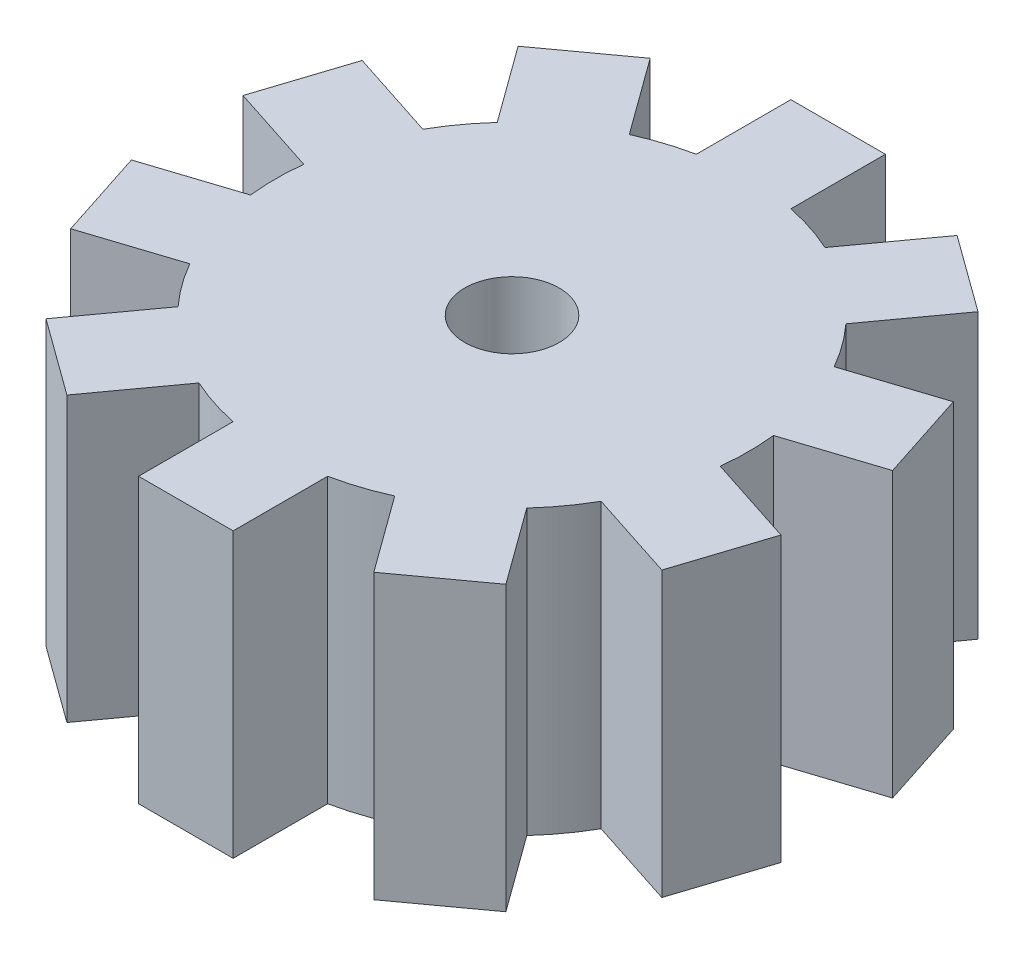
from build123d import *

# Parameters (mm, degrees)
SKETCH_1_R      = 5
EXTRUDE_1_DEPTH = 30


with BuildPart() as part:
    # 草圖1 → 填料-伸長1 (new body)
    with BuildSketch(Plane(origin=(0, 0, 0), x_dir=(1, 0, 0), z_dir=(0, 1, 0))):
        with BuildLine():
            Line((24.320676959, 24.968031977), (16.230507016, 30.8458845))
            Line((16.230507016, 30.8458845), (10.352654493, 22.755714556))
            ThreePointArc((10.352654493, 22.755714556), (7.725424859, 23.776412907), (5, 24.494897428))
            Line((5, 24.494897428), (5, 34.494897428))
            Line((5, 34.494897428), (-5, 34.494897428))
            Line((-5, 34.494897428), (-5, 24.494897428))
            ThreePointArc((-5, 24.494897428), (-7.725424859, 23.776412907), (-10.352654493, 22.755714556))
            Line((-10.352654493, 22.755714556), (-16.230507016, 30.8458845))
            Line((-16.230507016, 30.8458845), (-24.320676959, 24.968031977))
            Line((-24.320676959, 24.968031977), (-18.442824436, 16.877862033))
            ThreePointArc((-18.442824436, 16.877862033), (-20.225424859, 14.694631307), (-21.750946843, 12.324622162))
            Line((-21.750946843, 12.324622162), (-31.261512006, 15.414792106))
            Line((-31.261512006, 15.414792106), (-34.35168195, 5.904226943))
            Line((-34.35168195, 5.904226943), (-24.841116787, 2.814056999))
            ThreePointArc((-24.841116787, 2.814056999), (-25, 0), (-24.841116787, -2.814056999))
            Line((-24.841116787, -2.814056999), (-34.35168195, -5.904226943))
            Line((-34.35168195, -5.904226943), (-31.261512006, -15.414792106))
            Line((-31.261512006, -15.414792106), (-21.750946843, -12.324622162))
            ThreePointArc((-21.750946843, -12.324622162), (-20.225424859, -14.694631307), (-18.442824436, -16.877862033))
            Line((-18.442824436, -16.877862033), (-24.320676959, -24.968031977))
            Line((-24.320676959, -24.968031977), (-16.230507016, -30.8458845))
            Line((-16.230507016, -30.8458845), (-10.352654493, -22.755714556))
            ThreePointArc((-10.352654493, -22.755714556), (-7.725424859, -23.776412907), (-5, -24.494897428))
            Line((-5, -24.494897428), (-5, -34.494897428))
            Line((-5, -34.494897428), (5, -34.494897428))
            Line((5, -34.494897428), (5, -24.494897428))
            ThreePointArc((5, -24.494897428), (7.725424859, -23.776412907), (10.352654493, -22.755714556))
            Line((10.352654493, -22.755714556), (16.230507016, -30.8458845))
            Line((16.230507016, -30.8458845), (24.320676959, -24.968031977))
            Line((24.320676959, -24.968031977), (18.442824436, -16.877862033))
            ThreePointArc((18.442824436, -16.877862033), (20.225424859, -14.694631307), (21.750946843, -12.324622162))
            Line((21.750946843, -12.324622162), (31.261512006, -15.414792106))
            Line((31.261512006, -15.414792106), (34.35168195, -5.904226943))
            Line((34.35168195, -5.904226943), (24.841116787, -2.814056999))
            ThreePointArc((24.841116787, -2.814056999), (25, 0), (24.841116787, 2.814056999))
            Line((24.841116787, 2.814056999), (34.35168195, 5.904226943))
            Line((34.35168195, 5.904226943), (31.261512006, 15.414792106))
            Line((31.261512006, 15.414792106), (21.750946843, 12.324622162))
            ThreePointArc((21.750946843, 12.324622162), (20.225424859, 14.694631307), (18.442824436, 16.877862033))
            Line((18.442824436, 16.877862033), (24.320676959, 24.968031977))
        make_face()
        with Locations(Location((0, 0, 0), (0, 0, 270))):
            Circle(SKETCH_1_R, mode=Mode.SUBTRACT)
    extrude(amount=EXTRUDE_1_DEPTH)


solid = part.part
